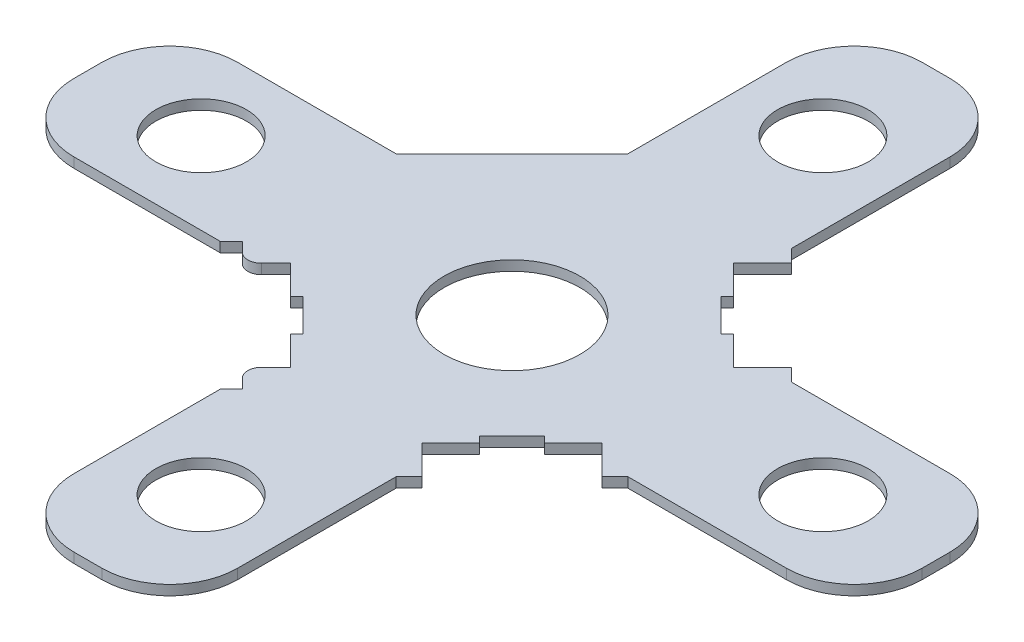
from build123d import *

# Parameters (mm, degrees)
SKETCH1_R           = 10
SKETCH1_R_2         = 15
BOSS_EXTRUDE1_DEPTH = 2.2


with BuildPart() as part:
    # Sketch1 → Boss-Extrude1 (new body)
    with BuildSketch(Plane(origin=(0, 0, 0), x_dir=(1, 0, 0), z_dir=(0, 1, 0))):
        with BuildLine():
            Line((28.996705531, 1.904265459), (33.969810226, 6.877370153))
            Line((33.969810226, 6.877370153), (31.141383101, 9.705797278))
            Line((31.141383101, 9.705797278), (31.141383101, 44.705797278))
            ThreePointArc((31.141383101, 44.705797278), (26.747984819, 55.312398995), (16.141383101, 59.705797278))
            Line((16.141383101, 59.705797278), (9.99459577, 59.705797278))
            ThreePointArc((9.99459577, 59.705797278), (-0.612005948, 55.312398995), (-5.00540423, 44.705797278))
            Line((-5.00540423, 44.705797278), (-5.00540423, 9.705797278))
            Line((-5.00540423, 9.705797278), (-30.56504267, -15.853841163))
            Line((-30.56504267, -15.853841163), (-65.56504267, -15.853841163))
            ThreePointArc((-65.56504267, -15.853841163), (-76.171644388, -20.247239445), (-80.56504267, -30.853841163))
            Line((-80.56504267, -30.853841163), (-80.56504267, -37.000628494))
            ThreePointArc((-80.56504267, -37.000628494), (-76.171644388, -47.607230212), (-65.56504267, -52.000628494))
            Line((-65.56504267, -52.000628494), (-33.289675478, -52.000628494))
            Line((-33.289675478, -52.000628494), (-30.843341676, -49.554294692))
            Line((-30.843341676, -49.554294692), (-28.773918492, -51.623717877))
            ThreePointArc((-28.773918492, -51.623717877), (-26.652598148, -52.502397534), (-24.531277804, -51.623717877))
            Line((-24.531277804, -51.623717877), (-22.763510851, -49.855950924))
            Line((-22.763510851, -49.855950924), (-21.349297289, -48.441737362))
            Line((-21.349297289, -48.441737362), (-14.985336258, -54.805698393))
            Line((-14.985336258, -54.805698393), (-13.571122696, -53.39148483))
            Line((-13.571122696, -53.39148483), (-6.396260567, -60.566346959))
            Line((-6.396260567, -60.566346959), (-7.810474129, -61.980560522))
            Line((-7.810474129, -61.980560522), (-1.446513098, -68.344521553))
            Line((-1.446513098, -68.344521553), (-2.860726661, -69.758735115))
            Line((-2.860726661, -69.758735115), (-4.628493614, -71.526502068))
            ThreePointArc((-4.628493614, -71.526502068), (-5.50717327, -73.647822411), (-4.628493614, -75.769142755))
            Line((-4.628493614, -75.769142755), (-2.559070429, -77.83856594))
            Line((-2.559070429, -77.83856594), (-5.00540423, -80.284899741))
            Line((-5.00540423, -80.284899741), (-5.00540423, -112.560266934))
            ThreePointArc((-5.00540423, -112.560266934), (-0.612005948, -123.166868652), (9.99459577, -127.560266934))
            Line((9.99459577, -127.560266934), (16.141383101, -127.560266934))
            ThreePointArc((16.141383101, -127.560266934), (26.747984819, -123.166868652), (31.141383101, -112.560266934))
            Line((31.141383101, -112.560266934), (31.141383101, -77.560266934))
            Line((31.141383101, -77.560266934), (33.969810226, -74.731839809))
            Line((33.969810226, -74.731839809), (28.996705531, -69.758735115))
            Line((28.996705531, -69.758735115), (27.582491969, -68.344521553))
            Line((27.582491969, -68.344521553), (33.946453, -61.980560522))
            Line((33.946453, -61.980560522), (32.532239437, -60.566346959))
            Line((32.532239437, -60.566346959), (39.707101567, -53.39148483))
            Line((39.707101567, -53.39148483), (41.121315129, -54.805698393))
            Line((41.121315129, -54.805698393), (47.48527616, -48.441737362))
            Line((47.48527616, -48.441737362), (48.899489722, -49.855950924))
            Line((48.899489722, -49.855950924), (53.872594416, -54.829055619))
            Line((53.872594416, -54.829055619), (56.701021541, -52.000628494))
            Line((56.701021541, -52.000628494), (91.701021541, -52.000628494))
            ThreePointArc((91.701021541, -52.000628494), (102.307623259, -47.607230212), (106.701021541, -37.000628494))
            Line((106.701021541, -37.000628494), (106.701021541, -30.853841163))
            ThreePointArc((106.701021541, -30.853841163), (102.307623259, -20.247239445), (91.701021541, -15.853841163))
            Line((91.701021541, -15.853841163), (56.701021541, -15.853841163))
            Line((56.701021541, -15.853841163), (53.872594416, -13.025414038))
            Line((53.872594416, -13.025414038), (48.899489722, -17.998518732))
            Line((48.899489722, -17.998518732), (47.48527616, -19.412732294))
            Line((47.48527616, -19.412732294), (41.121315129, -13.048771264))
            Line((41.121315129, -13.048771264), (39.707101567, -14.462984826))
            Line((39.707101567, -14.462984826), (32.532239437, -7.288122697))
            Line((32.532239437, -7.288122697), (33.946453, -5.873909135))
            Line((33.946453, -5.873909135), (27.582491969, 0.490051896))
            Line((27.582491969, 0.490051896), (28.996705531, 1.904265459))
        make_face()
        with Locations(Location((-55.56504267, -33.927234828, 0), (0, 0, 270))):
            Circle(SKETCH1_R, mode=Mode.SUBTRACT)
        with Locations(Location((13.067989435, -102.560266934, 0), (0, 0, 270))):
            Circle(SKETCH1_R, mode=Mode.SUBTRACT)
        with Locations(Location((13.067989435, -33.927234828, 0), (0, 0, 270))):
            Circle(SKETCH1_R_2, mode=Mode.SUBTRACT)
        with Locations(Location((81.701021541, -33.927234828, 0), (0, 0, 270))):
            Circle(SKETCH1_R, mode=Mode.SUBTRACT)
        with Locations(Location((13.067989435, 34.705797278, 0), (0, 0, 270))):
            Circle(SKETCH1_R, mode=Mode.SUBTRACT)
    extrude(amount=BOSS_EXTRUDE1_DEPTH)


solid = part.part
